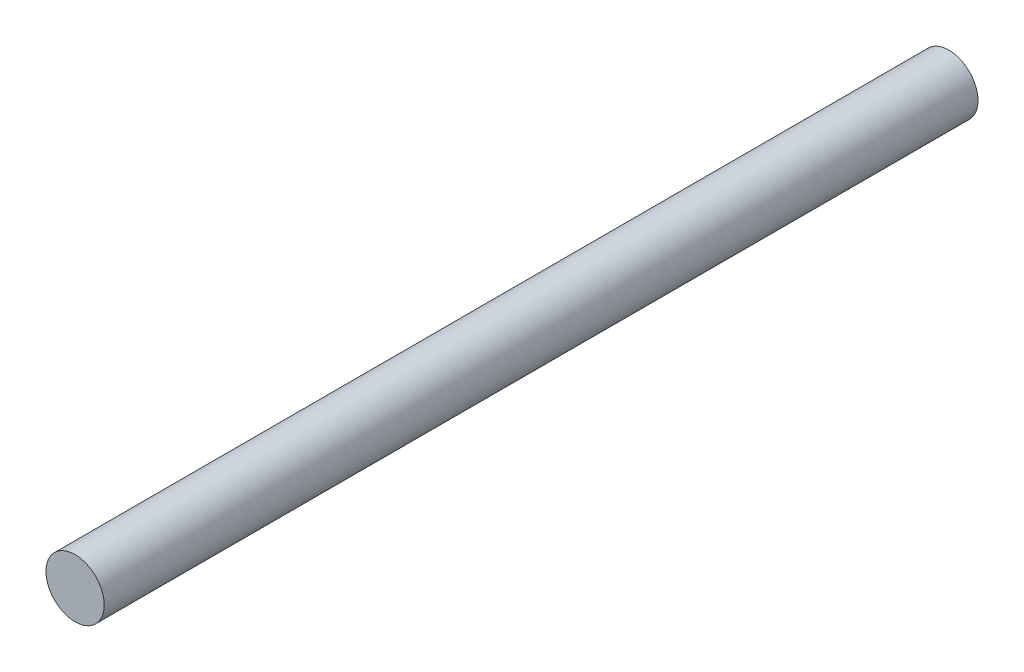
from build123d import *

# Parameters (mm, degrees)
SKETCH1_R           = 5
BOSS_EXTRUDE1_DEPTH = 75


with BuildPart() as part:
    # Sketch1 → Boss-Extrude1 (new, symmetric)
    with BuildSketch(Plane.XY):
        Circle(SKETCH1_R)
    extrude(amount=BOSS_EXTRUDE1_DEPTH, both=True)


solid = part.part
